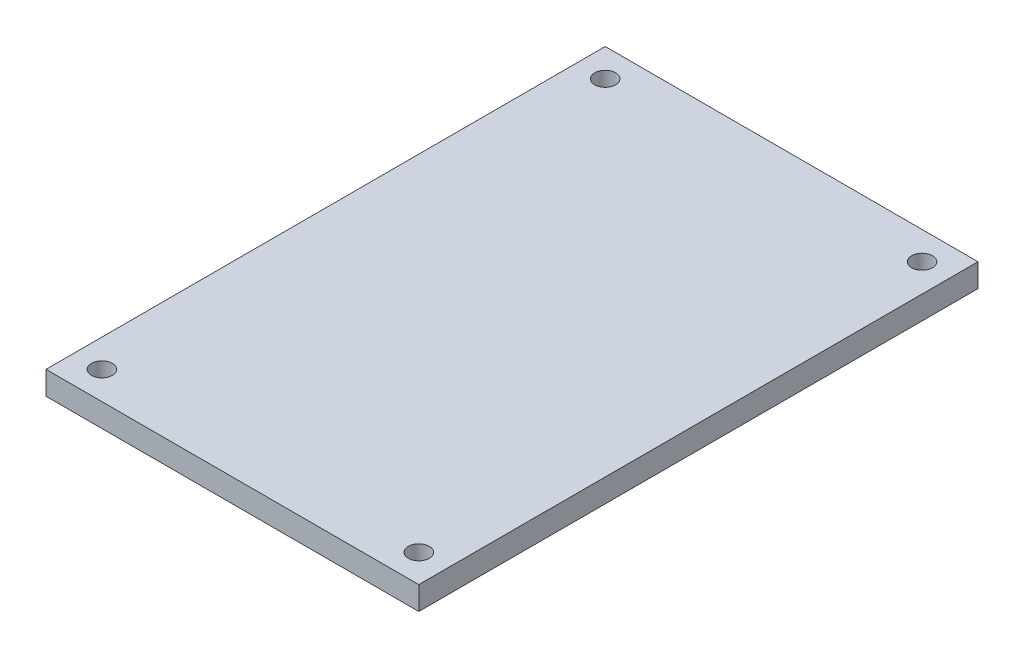
from build123d import *

# Parameters (mm, degrees)
SKETCH1_W           = 50.8
SKETCH1_H           = 76.2
SKETCH1_R           = 1.4224
BOSS_EXTRUDE1_DEPTH = 3.175


with BuildPart() as part:
    # Sketch1 → Boss-Extrude1 (new body)
    with BuildSketch(Plane(origin=(0, 0, 0), x_dir=(1, 0, 0), z_dir=(0, 1, 0))):
        with Locations((25.4, 38.1)):
            Rectangle(SKETCH1_W, SKETCH1_H)
        with Locations(Location((3.81, 3.81, 0), (0, 0, 270))):
            Circle(SKETCH1_R, mode=Mode.SUBTRACT)
        with Locations(Location((3.81, 72.39, 0), (0, 0, 90))):
            Circle(SKETCH1_R, mode=Mode.SUBTRACT)
        with Locations(Location((46.99, 3.81, 0), (0, 0, 90))):
            Circle(SKETCH1_R, mode=Mode.SUBTRACT)
        with Locations(Location((46.99, 72.39, 0), (0, 0, 270))):
            Circle(SKETCH1_R, mode=Mode.SUBTRACT)
    extrude(amount=BOSS_EXTRUDE1_DEPTH)


solid = part.part
